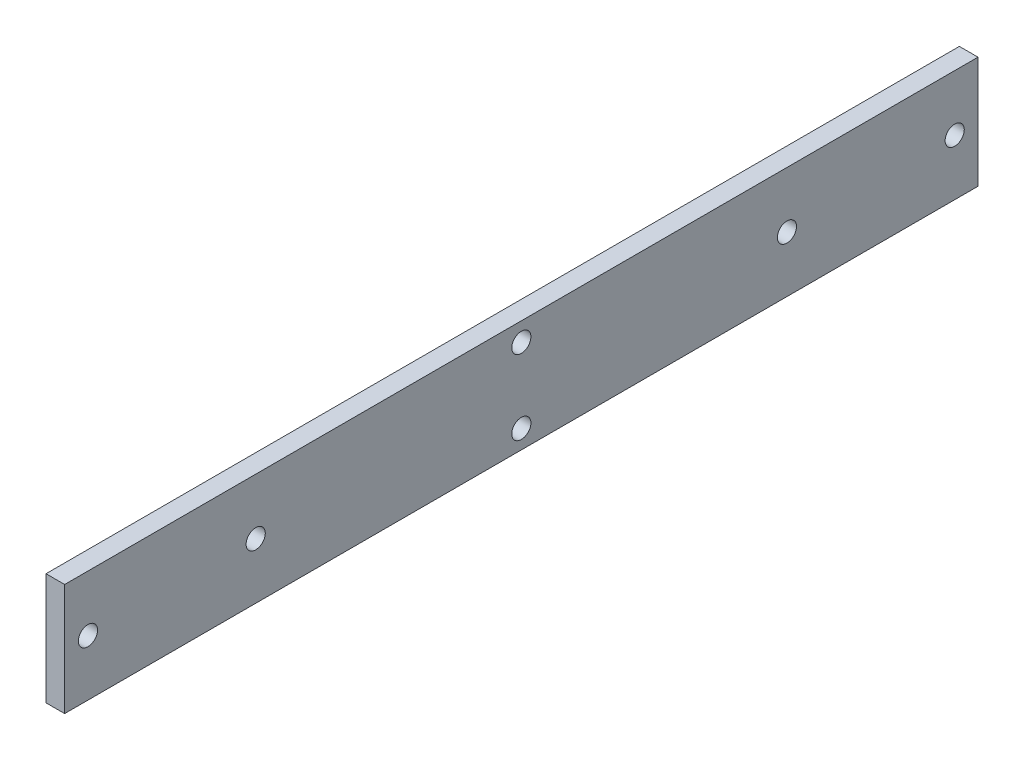
from build123d import *

# Parameters (mm, degrees)
SKETCH1_W               = 6.35
SKETCH1_H               = 38.1
BOSS_EXTRUDE1_DEPTH     = 155.575
F_1_4_CLEARANCE_HOLE1_D = 6.5278


with BuildPart() as part:
    # Sketch1 → Boss-Extrude1 (new, symmetric)
    with BuildSketch(Plane.XY):
        Rectangle(SKETCH1_W, SKETCH1_H)
    extrude(amount=BOSS_EXTRUDE1_DEPTH, both=True)

    # 1/4 Clearance Hole1 (through all)
    with Locations(Plane(origin=(3.175, 0, 0), x_dir=(0, 0, -1), z_dir=(1, 0, 0))):
        with Locations((-147.6375, 0), (-90.4875, 0), (90.4875, 0), (147.6375, 0), (0, 12.7), (0, -12.7)):
            Hole(F_1_4_CLEARANCE_HOLE1_D / 2)


solid = part.part
